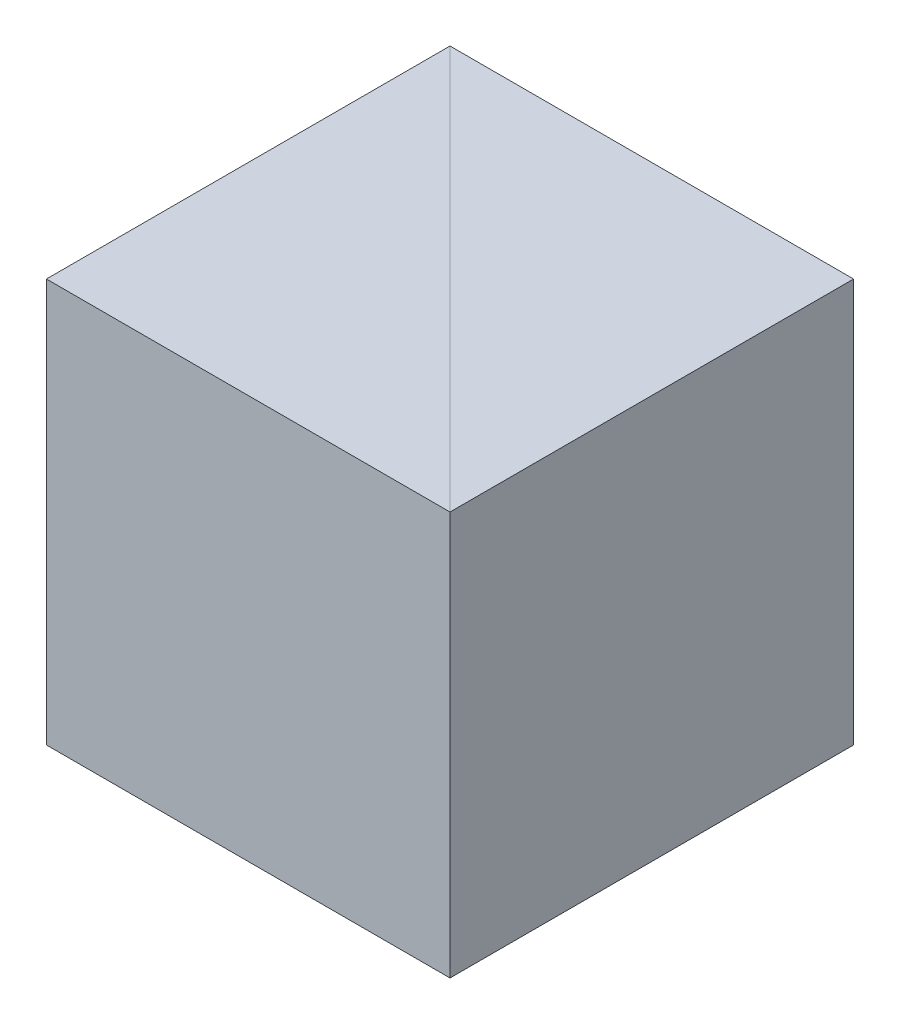
from build123d import *

# Parameters (mm, degrees)
SKETCH1_W           = 40
SKETCH1_H           = 40
BOSS_EXTRUDE1_DEPTH = 40


with BuildPart() as part:
    # Sketch1 → Boss-Extrude1 (new body)
    with BuildSketch(Plane(origin=(0, 0, 0), x_dir=(1, 0, 0), z_dir=(0, 1, 0))):
        Rectangle(SKETCH1_W, SKETCH1_H)
    extrude(amount=BOSS_EXTRUDE1_DEPTH)


with BuildPart() as body_2:
    # Split1: the piece on the far side of the plane
    add(part.part)
    split(bisect_by=Plane(origin=(0, 0, 0), x_dir=(-0.7071067811865475, 0, -0.7071067811865477), z_dir=(-0.7071067811865477, 0, 0.7071067811865475)), keep=Keep.BOTTOM)


with BuildPart() as part_1:
    add(part.part)

    # Split1
    split(bisect_by=Plane(origin=(0, 0, 0), x_dir=(-0.7071067811865475, 0, -0.7071067811865477), z_dir=(-0.7071067811865477, 0, 0.7071067811865475)), keep=Keep.TOP)


solid = Compound([body_2.part, part_1.part])
